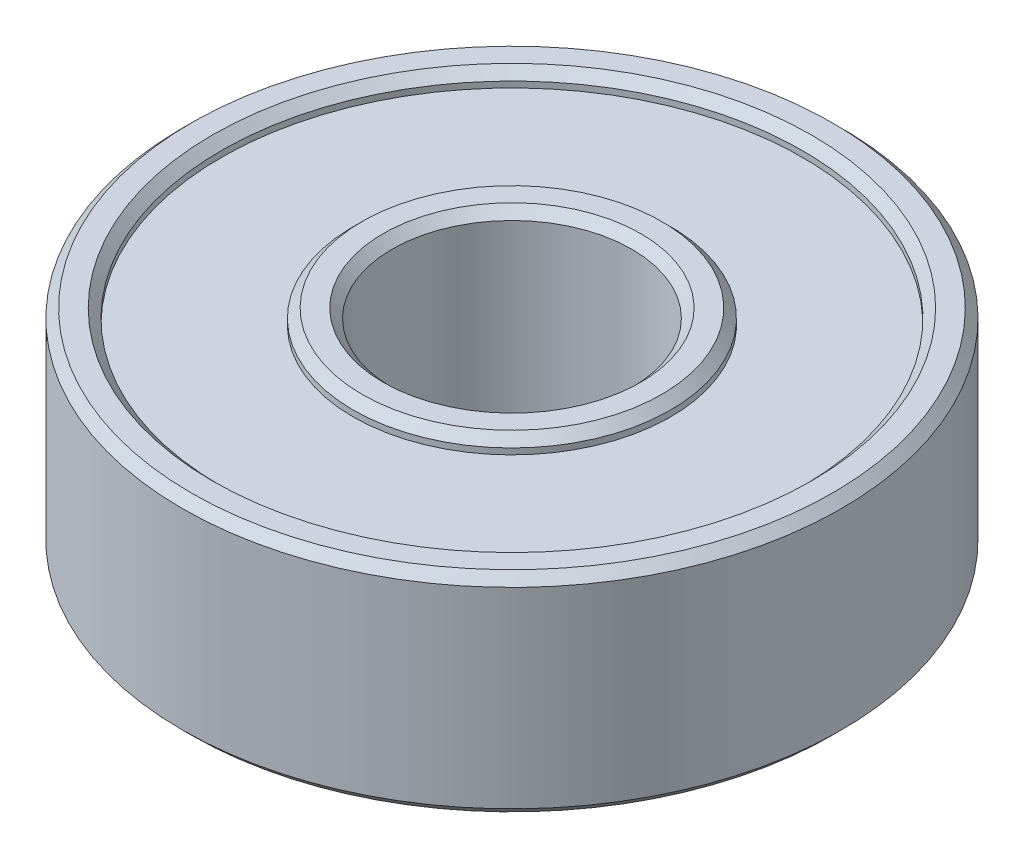
from build123d import *


with BuildPart() as part:
    # Sketch1 → Revolve1 (revolve)
    with BuildSketch(Plane(origin=(0, 0, 0), x_dir=(-1, 0, 0), z_dir=(0, 0, -1)), mode=Mode.PRIVATE) as revolve1_sk:
        Polygon((-4, 3.2), (-4.3, 3.5), (-5, 3.5), (-5.3, 3.2), (-5.3, 3), (-9.7, 3), (-9.7, 3.2), (-10, 3.5), (-10.7, 3.5), (-11, 3.2), (-11, -3.2), (-10.7, -3.5), (-10, -3.5), (-9.7, -3.2), (-9.7, -3), (-5.3, -3), (-5.3, -3.2), (-5, -3.5), (-4.3, -3.5), (-4, -3.2), align=None)
    revolve(revolve1_sk.sketch.rotate(Axis((0, -3.5, 0), (0, 1, 0)), 270), axis=Axis((0, -3.5, 0), (0, 1, 0)))


solid = part.part
